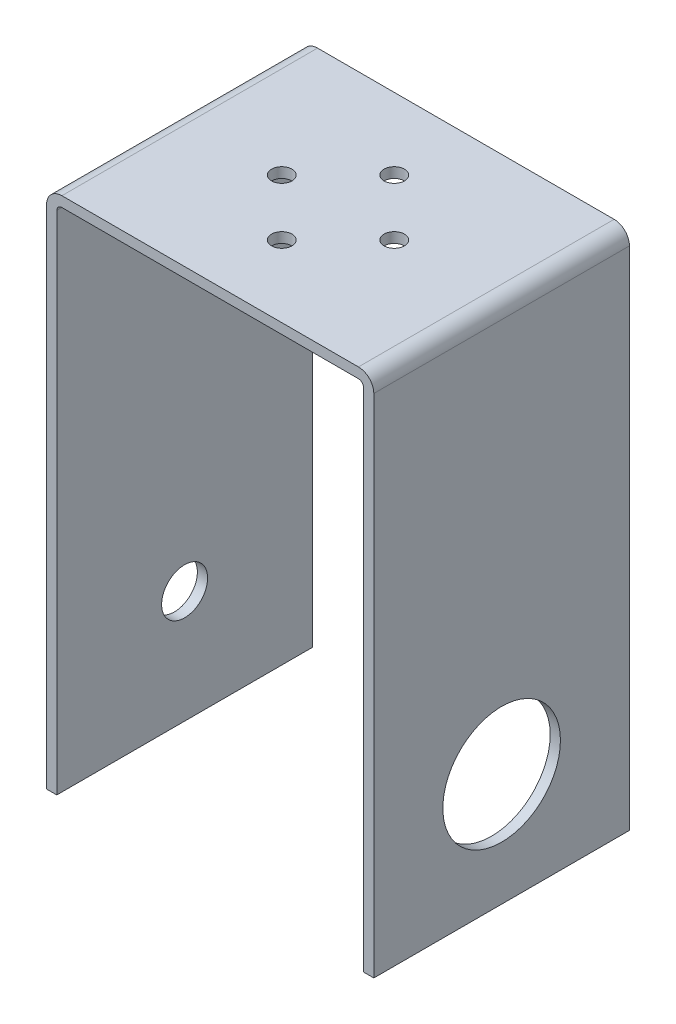
from build123d import *

# Parameters (mm, degrees)
BOSS_EXTRUDE1_DEPTH = 50
FILLET1_R           = 1
FILLET2_R           = 3
SKETCH2_R           = 2
CUT_EXTRUDE1_DEPTH  = 10
SKETCH4_R           = 11.5
CUT_EXTRUDE3_DEPTH  = 17
SKETCH5_R           = 4.5
CUT_EXTRUDE4_DEPTH  = 3


with BuildPart() as part:
    # Sketch1 → Boss-Extrude1 (new body)
    with BuildSketch(Plane.XY):
        Polygon((-32, -50), (-32, 52), (32, 52), (32, -50), (30, -50), (30, 50), (-30, 50), (-30, -50), align=None)
    extrude(amount=BOSS_EXTRUDE1_DEPTH)

    # Fillet1
    fillet1_edges = [part.edges().sort_by_distance(p)[0] for p in [
        (30, 50, 25),
        (-30, 50, 25),
    ]]
    fillet(fillet1_edges, radius=FILLET1_R)

    # Fillet2
    fillet2_edges = [part.edges().sort_by_distance(p)[0] for p in [
        (-32, 52, 25),
        (32, 52, 25),
    ]]
    fillet(fillet2_edges, radius=FILLET2_R)

    # Sketch2 → Cut-Extrude1 (cut)
    with BuildSketch(Plane(origin=(0, 52, 0), x_dir=(1, 0, 0), z_dir=(0, 1, 0))):
        with Locations(Location((0, -14, 0), (0, 0, 270))):
            Circle(SKETCH2_R)
        with Locations(Location((11, -25, 0), (0, 0, 270))):
            Circle(SKETCH2_R)
        with Locations(Location((0, -36, 0), (0, 0, 270))):
            Circle(SKETCH2_R)
        with Locations(Location((-11, -25, 0), (0, 0, 270))):
            Circle(SKETCH2_R)
    extrude(amount=-CUT_EXTRUDE1_DEPTH, mode=Mode.SUBTRACT)

    # Sketch4 → Cut-Extrude3 (cut)
    with BuildSketch(Plane(origin=(32, 0, 0), x_dir=(0, 0, -1), z_dir=(1, 0, 0))):
        with Locations((-25, -28)):
            Circle(SKETCH4_R)
    extrude(amount=-CUT_EXTRUDE3_DEPTH, mode=Mode.SUBTRACT)

    # Sketch5 → Cut-Extrude4 (cut)
    with BuildSketch(Plane(origin=(-30, 0, 0), x_dir=(0, 0, -1), z_dir=(1, 0, 0))):
        with Locations((-25, -28)):
            Circle(SKETCH5_R)
    extrude(amount=-CUT_EXTRUDE4_DEPTH, mode=Mode.SUBTRACT)


solid = part.part
